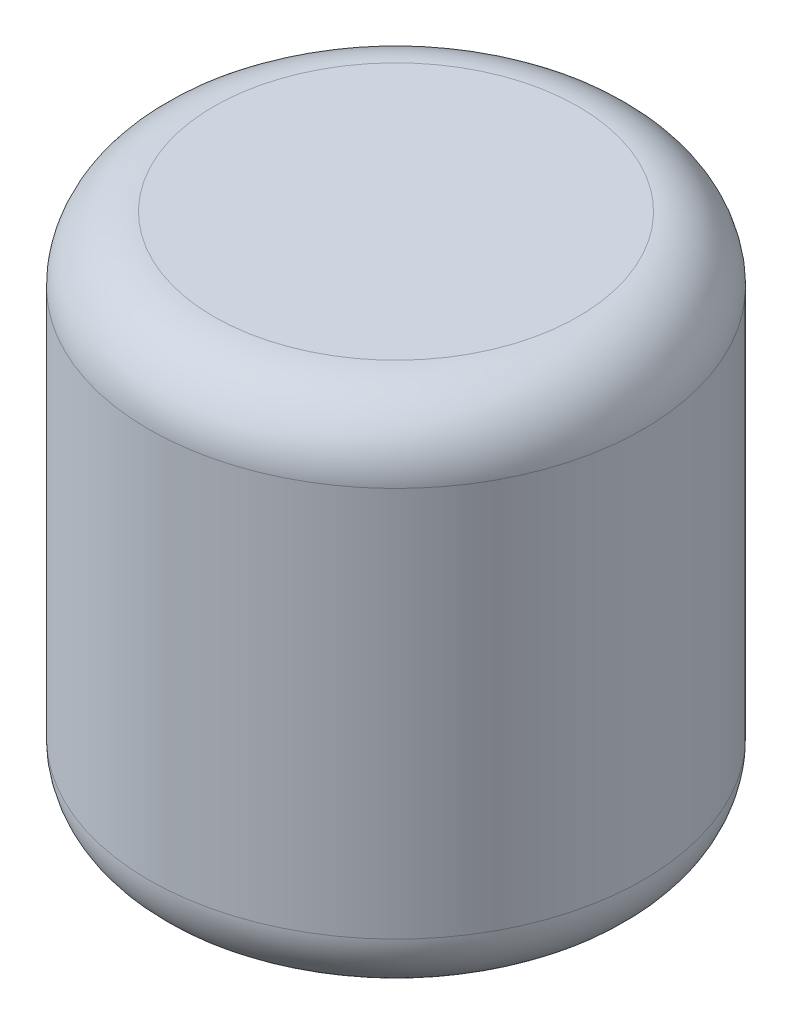
from build123d import *

# Parameters (mm, degrees)
SKETCH1_R           = 1.9
BOSS_EXTRUDE1_DEPTH = 4
FILLET1_R           = 0.5


with BuildPart() as part:
    # Sketch1 → Boss-Extrude1 (new body)
    with BuildSketch(Plane(origin=(0, 0, 0), x_dir=(1, 0, 0), z_dir=(0, 1, 0))):
        with Locations(Location((0, 0, 0), (0, 0, 270))):
            Circle(SKETCH1_R)
    extrude(amount=BOSS_EXTRUDE1_DEPTH)

    # Fillet1
    fillet1_edges = [part.edges().sort_by_distance(p)[0] for p in [
        (0, 0, -1.9),
        (0, 4, -1.9),
    ]]
    fillet(fillet1_edges, radius=FILLET1_R)


solid = part.part
